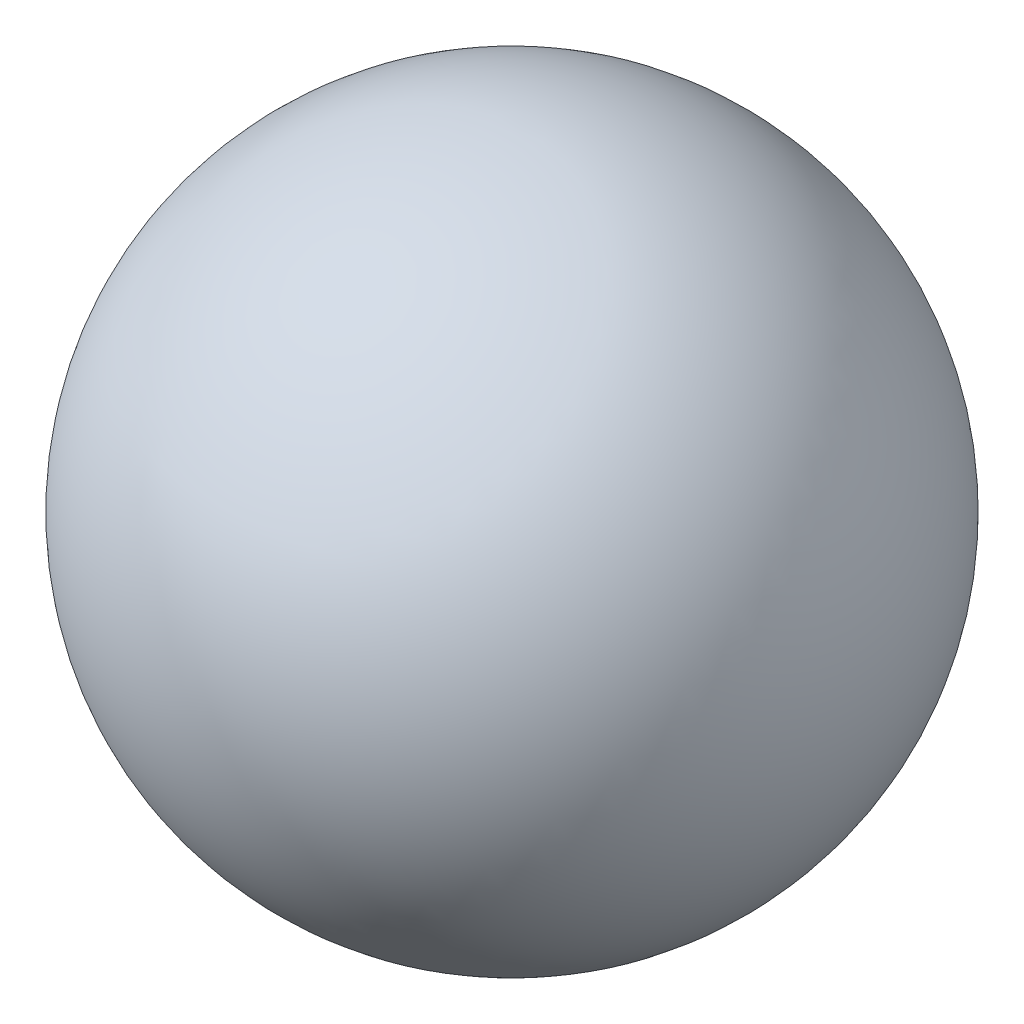
from build123d import *


with BuildPart() as part:
    # Sketch1 → Revolve2 (revolve)
    with BuildSketch(Plane.XY):
        with BuildLine():
            Line((0, -2.25), (0, 2.25))
            ThreePointArc((0, 2.25), (-2.25, 0), (0, -2.25))
        make_face()
    revolve(axis=Axis((0, -2.25, 0), (0, 1, 0)))


solid = part.part
